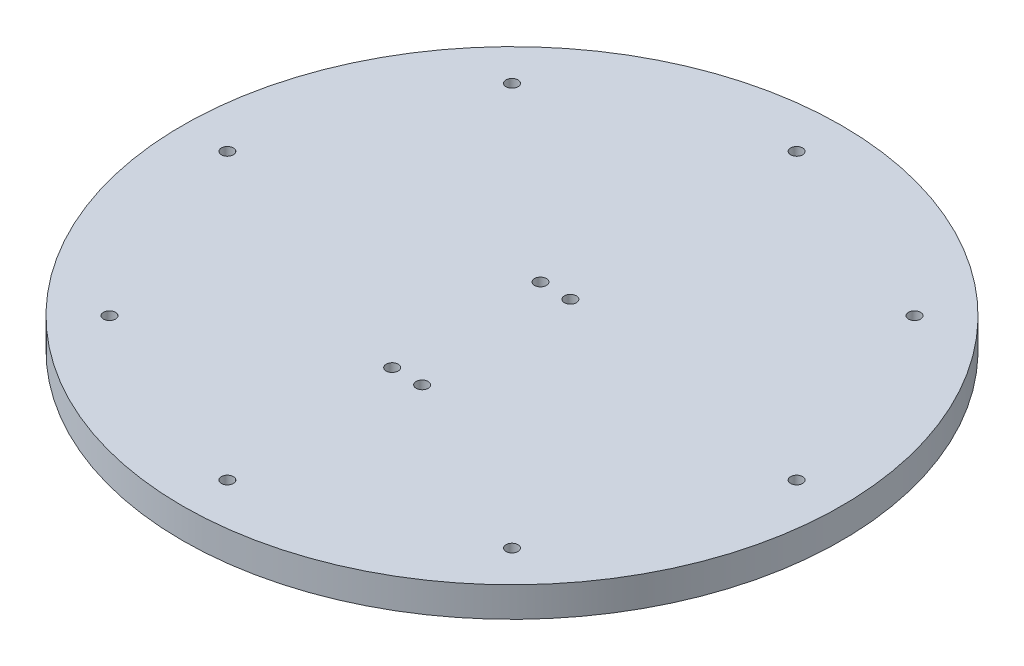
from build123d import *

# Parameters (mm, degrees)
SKETCH2_R           = 110
BOSS_EXTRUDE2_DEPTH = 10
SKETCH3_R           = 2
CUT_EXTRUDE1_DEPTH  = 10
SKETCH4_R           = 5
CUT_EXTRUDE2_DEPTH  = 6
SKETCH5_R           = 2
CUT_EXTRUDE3_DEPTH  = 156.884572681
CUT_EXTRUDE9_START  = -6
SKETCH7_R           = 4.5
SKETCH7_R_2         = 2
CUT_EXTRUDE9_DEPTH  = 6
SKETCH8_R           = 4.5
CUT_EXTRUDE10_DEPTH = 6


with BuildPart() as part:
    # Sketch2 → Boss-Extrude2 (new body)
    with BuildSketch(Plane(origin=(0, 0, 0), x_dir=(1, 0, 0), z_dir=(0, 1, 0))):
        with Locations(Location((0, 0, 0), (0, 0, 270))):
            Circle(SKETCH2_R)
    extrude(amount=BOSS_EXTRUDE2_DEPTH)

    # Sketch3 → Cut-Extrude1 (cut)
    with BuildSketch(Plane(origin=(0, 10, 0), x_dir=(1, 0, 0), z_dir=(0, 1, 0))):
        with Locations(Location((0, 95, 0), (0, 0, 270))):
            Circle(SKETCH3_R)
        with Locations(Location((67.175144213, 67.175144213, 0), (0, 0, 270))):
            Circle(SKETCH3_R)
        with Locations(Location((95, 0, 0), (0, 0, 270))):
            Circle(SKETCH3_R)
        with Locations(Location((67.175144213, -67.175144213, 0), (0, 0, 270))):
            Circle(SKETCH3_R)
        with Locations(Location((0, -95, 0), (0, 0, 270))):
            Circle(SKETCH3_R)
        with Locations(Location((-67.175144213, -67.175144213, 0), (0, 0, 270))):
            Circle(SKETCH3_R)
        with Locations(Location((-95, 0, 0), (0, 0, 270))):
            Circle(SKETCH3_R)
        with Locations(Location((-67.175144213, 67.175144213, 0), (0, 0, 270))):
            Circle(SKETCH3_R)
    extrude(amount=-CUT_EXTRUDE1_DEPTH, mode=Mode.SUBTRACT)

    # Sketch4 → Cut-Extrude2 (cut)
    with BuildSketch(Plane(origin=(0, 0, 0), x_dir=(1, 0, 0), z_dir=(0, 1, 0))):
        with Locations(Location((0, 95, 0), (0, 0, 270))):
            Circle(SKETCH4_R)
        with Locations(Location((67.175144213, 67.175144213, 0), (0, 0, 270))):
            Circle(SKETCH4_R)
        with Locations(Location((95, 0, 0), (0, 0, 270))):
            Circle(SKETCH4_R)
        with Locations(Location((67.175144213, -67.175144213, 0), (0, 0, 270))):
            Circle(SKETCH4_R)
        with Locations(Location((0, -95, 0), (0, 0, 270))):
            Circle(SKETCH4_R)
        with Locations(Location((-67.175144213, -67.175144213, 0), (0, 0, 270))):
            Circle(SKETCH4_R)
        with Locations(Location((-95, 0, 0), (0, 0, 270))):
            Circle(SKETCH4_R)
        with Locations(Location((-67.175144213, 67.175144213, 0), (0, 0, 270))):
            Circle(SKETCH4_R)
    extrude(amount=CUT_EXTRUDE2_DEPTH, mode=Mode.SUBTRACT)

    # Sketch5 → Cut-Extrude3 (cut, through all)
    with BuildSketch(Plane(origin=(0, 10, 0), x_dir=(1, 0, 0), z_dir=(0, 1, 0))):
        with Locations(Location((5, 14.5, 0), (0, 0, 270))):
            Circle(SKETCH5_R)
        with Locations(Location((-5, 14.5, 0), (0, 0, 270))):
            Circle(SKETCH5_R)
        with Locations(Location((5, -35, 0), (0, 0, 270))):
            Circle(SKETCH5_R)
        with Locations(Location((-5, -35, 0), (0, 0, 270))):
            Circle(SKETCH5_R)
    extrude(amount=-CUT_EXTRUDE3_DEPTH, mode=Mode.SUBTRACT)

    # Sketch7 → Cut-Extrude9 (cut)
    # profile 1 of 2: a face of its own
    with BuildSketch(Plane.XZ.offset(CUT_EXTRUDE9_START)):
        with Locations(Location((5, -14.5, 0), (0, 0, 270))):
            Circle(SKETCH7_R)
        with Locations(Location((5, -14.5, 0), (0, 0, 90))):
            Circle(SKETCH7_R_2, mode=Mode.SUBTRACT)
    # profile 2 of 2: a face of its own
    with BuildSketch(Plane.XZ.offset(CUT_EXTRUDE9_START)):
        with Locations(Location((-5, -14.5, 0), (0, 0, 270))):
            Circle(SKETCH7_R)
        with Locations(Location((-5, -14.5, 0), (0, 0, 90))):
            Circle(SKETCH7_R_2, mode=Mode.SUBTRACT)
    extrude(amount=CUT_EXTRUDE9_DEPTH, mode=Mode.SUBTRACT)

    # Sketch8 → Cut-Extrude10 (cut)
    with BuildSketch(Plane.XZ):
        with Locations(Location((5, 35, 0), (0, 0, 270))):
            Circle(SKETCH8_R)
        with Locations(Location((-5, 35, 0), (0, 0, 270))):
            Circle(SKETCH8_R)
    extrude(amount=-CUT_EXTRUDE10_DEPTH, mode=Mode.SUBTRACT)


solid = part.part
